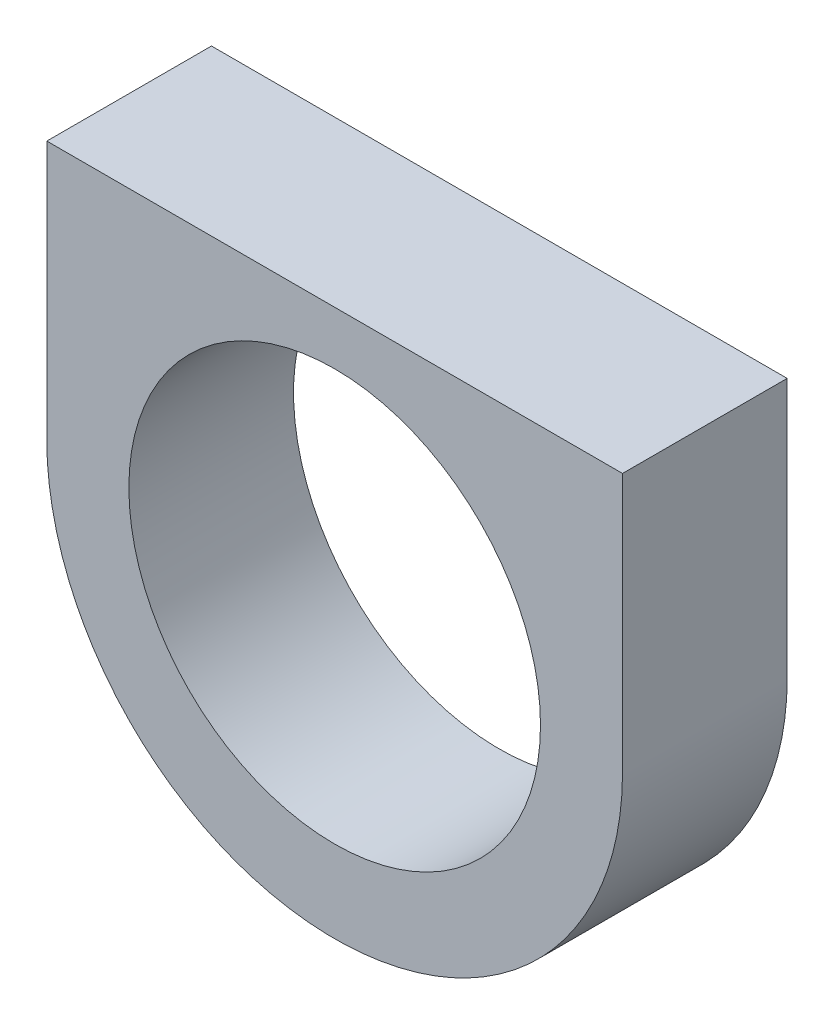
from build123d import *

# Parameters (mm, degrees)
CUT_EXTRUDE1_DEPTH      = 16.539441625
CUT_EXTRUDE1_DEPTH_BACK = 16.539441625
SKETCH2_R               = 5


with BuildPart() as part:
    # Sketch1 → Loft1 section 0
    with BuildSketch(Plane.XY):
        with BuildLine():
            Line((6.993136448, 0), (-6.993136448, 0))
            Line((-6.993136448, 0), (-6.993136448, -6.29483871))
            ThreePointArc((-6.993136448, -6.29483871), (0, -13.287975158), (6.993136448, -6.29483871))
            Line((6.993136448, -6.29483871), (6.993136448, 0))
        make_face()
    # Sketch3 → Loft1 section 1
    with BuildSketch(Plane(origin=(0, 0, 4), x_dir=(-1, 0, 0), z_dir=(0, 0, -1))):
        with BuildLine():
            Line((6.993136448, 0), (-6.993136448, 0))
            Line((-6.993136448, 0), (-6.993136448, -6.29483871))
            ThreePointArc((-6.993136448, -6.29483871), (0, -13.287975158), (6.993136448, -6.29483871))
            Line((6.993136448, -6.29483871), (6.993136448, 0))
        make_face()
    loft()

    # Sketch2 → Cut-Extrude1 (cut, two sides: drawn at the far end of the back side and taken through both)
    with BuildSketch(Plane.XY.offset(-CUT_EXTRUDE1_DEPTH_BACK)):
        with Locations((0, -6.29483871)):
            Circle(SKETCH2_R)
    extrude(amount=CUT_EXTRUDE1_DEPTH + CUT_EXTRUDE1_DEPTH_BACK, mode=Mode.SUBTRACT)


solid = part.part
